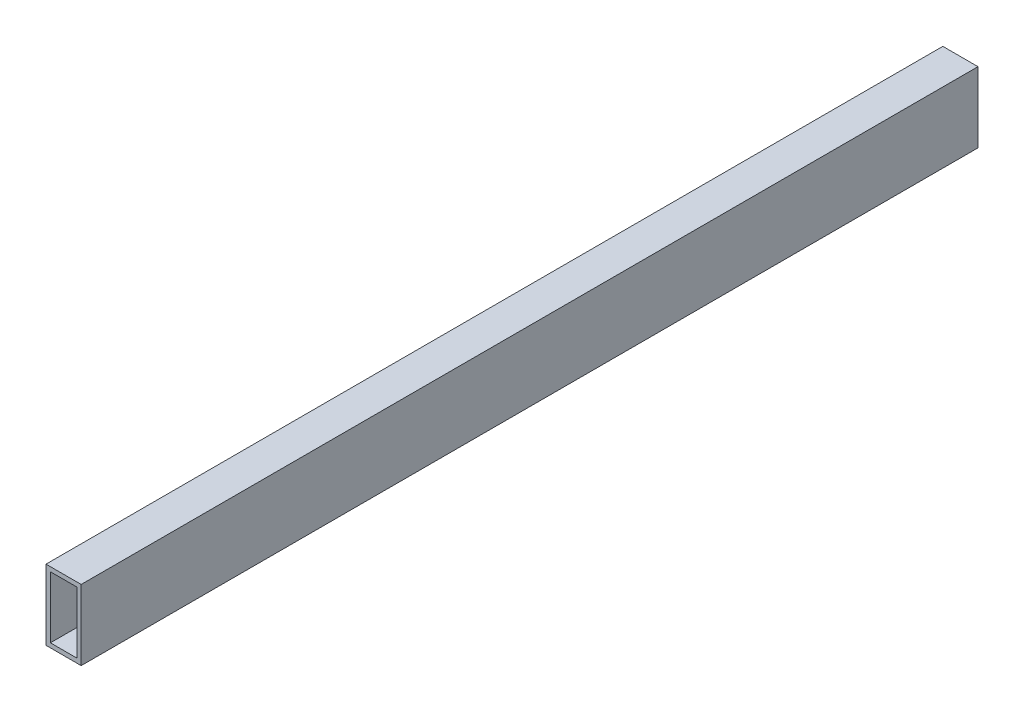
from build123d import *

# Parameters (mm, degrees)
SKETCH1_W           = 25.4
SKETCH1_H           = 50.8
SKETCH1_W_2         = 19.05
SKETCH1_H_2         = 44.45
BOSS_EXTRUDE1_DEPTH = 323.85


with BuildPart() as part:
    # Sketch1 → Boss-Extrude1 (new, symmetric)
    with BuildSketch(Plane.XY):
        Rectangle(SKETCH1_W, SKETCH1_H)
        Rectangle(SKETCH1_W_2, SKETCH1_H_2, mode=Mode.SUBTRACT)
    extrude(amount=BOSS_EXTRUDE1_DEPTH, both=True)


solid = part.part
